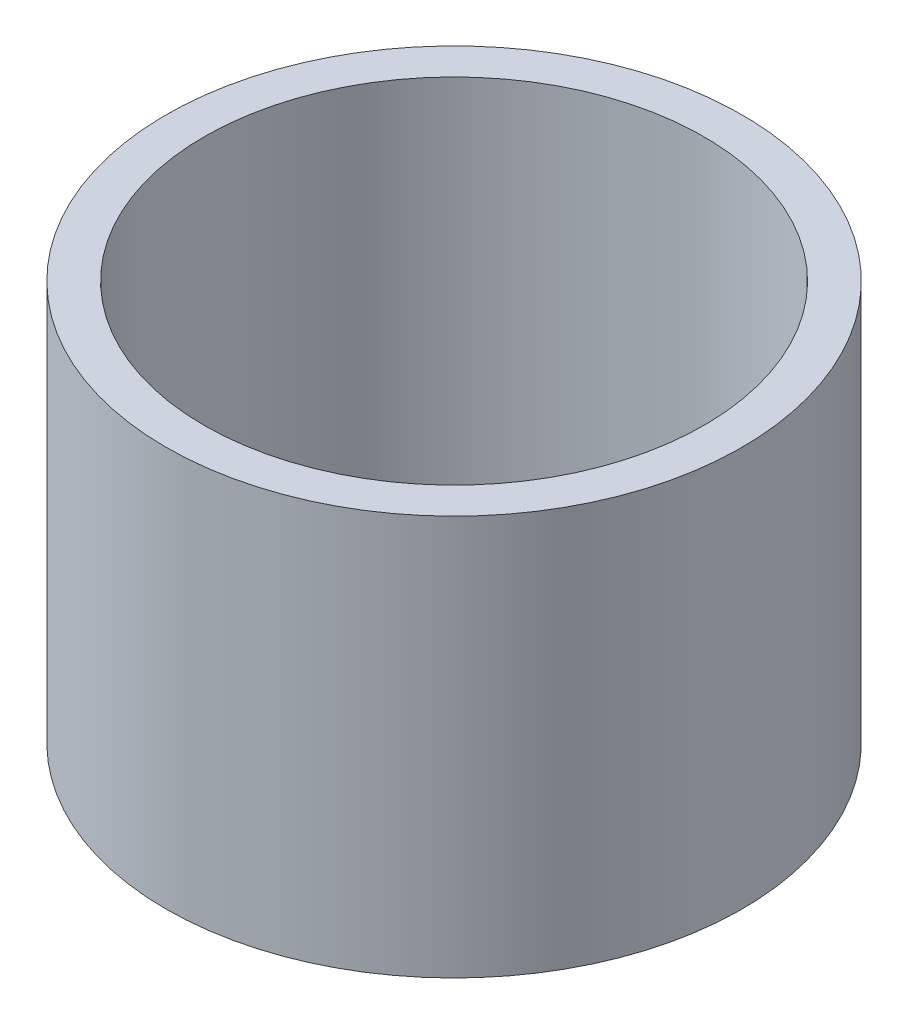
from build123d import *

# Parameters (mm, degrees)
SKETCH1_R           = 3.6
BOSS_EXTRUDE1_DEPTH = 5
SKETCH2_R           = 3.125
CUT_EXTRUDE1_DEPTH  = 4.5


with BuildPart() as part:
    # Sketch1 → Boss-Extrude1 (new body)
    with BuildSketch(Plane(origin=(0, 0, 0), x_dir=(1, 0, 0), z_dir=(0, 1, 0))):
        with Locations(Location((0, 0, 0), (0, 0, 270))):
            Circle(SKETCH1_R)
    extrude(amount=BOSS_EXTRUDE1_DEPTH)

    # Sketch2 → Cut-Extrude1 (cut)
    with BuildSketch(Plane(origin=(0, 5, 0), x_dir=(1, 0, 0), z_dir=(0, 1, 0))):
        with Locations(Location((0, 0, 0), (0, 0, 270))):
            Circle(SKETCH2_R)
    extrude(amount=-CUT_EXTRUDE1_DEPTH, mode=Mode.SUBTRACT)


solid = part.part
